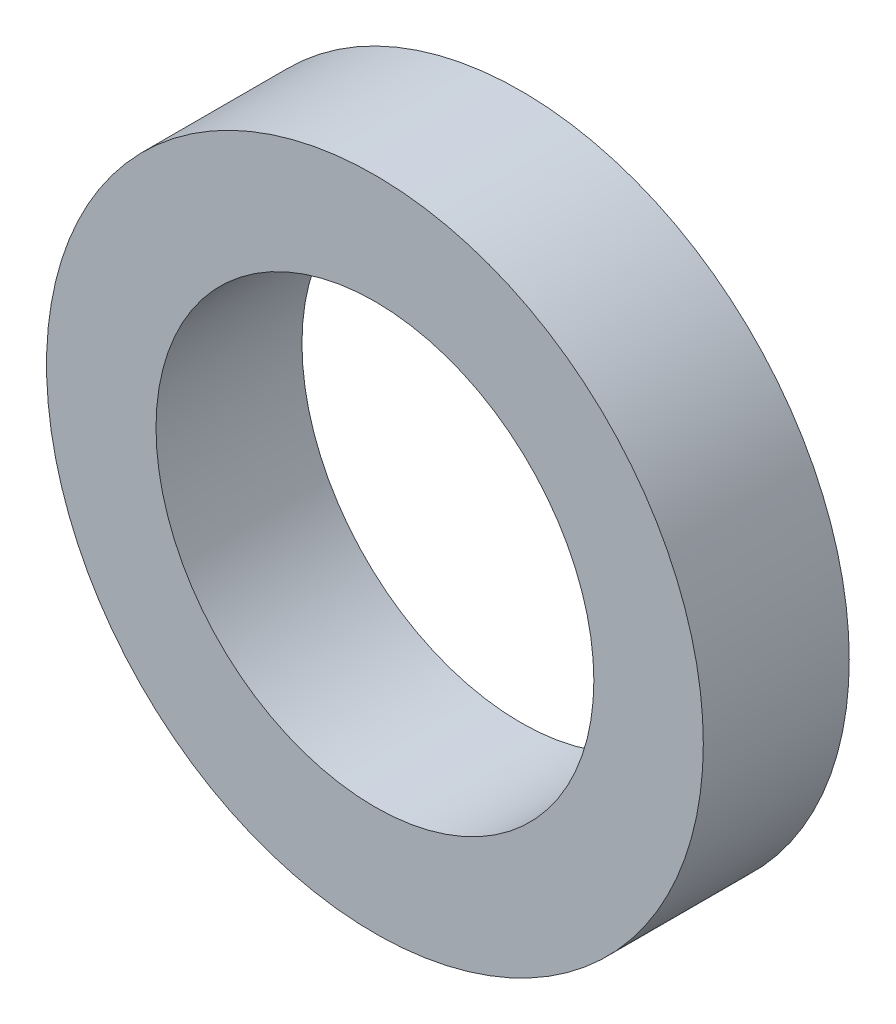
from build123d import *

# Parameters (mm, degrees)
SKETCH_1_R      = 9
SKETCH_1_R_2    = 6
EXTRUDE_1_DEPTH = 2


with BuildPart() as part:
    # 草图1 → 凸台-拉伸1 (new, symmetric)
    with BuildSketch(Plane.XY):
        Circle(SKETCH_1_R)
        Circle(SKETCH_1_R_2, mode=Mode.SUBTRACT)
    extrude(amount=EXTRUDE_1_DEPTH, both=True)


solid = part.part
